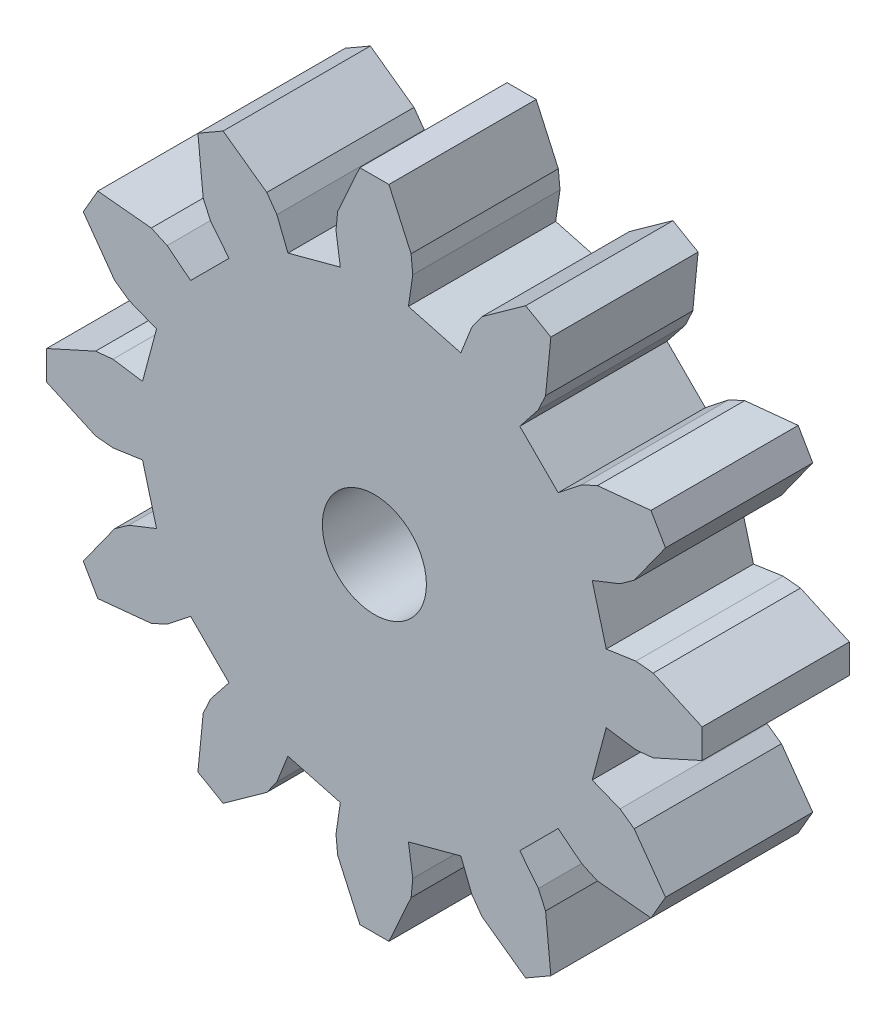
from build123d import *

# Parameters (mm, degrees)
BOSS_EXTRUDE1_DEPTH = 3
SKETCH2_R           = 1.06
CUT_EXTRUDE1_DEPTH  = 3


with BuildPart() as part:
    # Model → Boss-Extrude1 (new body)
    with BuildSketch(Plane.XY):
        Polygon((85.038482334, 125.842661122), (85.641402334, 125.931201122), (85.995047634, 125.896821579), (86.992422179, 125.445319522), (86.992422179, 124.852599522), (85.995047634, 124.401097464), (85.641402334, 124.366717921), (85.038482334, 124.455257921), (84.752432117, 123.387727108), (85.31884426, 123.162940226), (85.607924576, 122.95635), (86.245924576, 122.06665), (85.949564326, 121.553339567), (84.86006114, 121.661009882), (84.536608908, 121.80806635), (84.058733602, 122.186202635), (83.277245674, 121.404714707), (83.65538196, 120.926839402), (83.802438428, 120.60338717), (83.910108743, 119.513883983), (83.39679831, 119.217523733), (82.50709831, 119.855523733), (82.300508083, 120.14460405), (82.075721201, 120.711016193), (81.008190388, 120.424965975), (81.096730388, 119.822045975), (81.062350845, 119.468400675), (80.610848788, 118.471026131), (80.018128788, 118.471026131), (79.566626731, 119.468400675), (79.532247188, 119.822045975), (79.620787188, 120.424965975), (78.553256375, 120.711016193), (78.328469493, 120.14460405), (78.121879267, 119.855523733), (77.232179267, 119.217523733), (76.718868834, 119.513883983), (76.826539148, 120.60338717), (76.973595617, 120.926839402), (77.351731902, 121.404714707), (76.570243974, 122.186202635), (76.092368668, 121.80806635), (75.768916436, 121.661009882), (74.67941325, 121.553339567), (74.383053, 122.06665), (75.021053, 122.95635), (75.310133317, 123.162940226), (75.87654546, 123.387727108), (75.590503, 124.45526), (74.987583, 124.36672), (74.633937545, 124.401097943), (73.636563, 124.8526), (73.636563, 125.44532), (74.633937545, 125.896822057), (74.987582844, 125.9312016), (75.590502844, 125.8426616), (75.876553062, 126.910192413), (75.310140919, 127.134979295), (75.021060603, 127.341569522), (74.383060603, 128.231269522), (74.679420853, 128.744579955), (75.768924039, 128.63690964), (76.092376271, 128.489853171), (76.570251576, 128.111716886), (77.351739505, 128.893204814), (76.973603219, 129.37108012), (76.826546751, 129.694532352), (76.718876436, 130.784035538), (77.232186869, 131.080395788), (78.121886869, 130.442395788), (78.328477095, 130.153315471), (78.553263977, 129.586903328), (79.62079479, 129.872953546), (79.53225479, 130.475873546), (79.566634333, 130.829518846), (80.018136391, 131.826893391), (80.610856391, 131.826893391), (81.062358448, 130.829518846), (81.096737991, 130.475873546), (81.008197991, 129.872953546), (82.075728804, 129.586903328), (82.300515686, 130.153315471), (82.507105912, 130.442395788), (83.396805912, 131.080395788), (83.910116345, 130.784035538), (83.80244603, 129.694532352), (83.655389562, 129.37108012), (83.277253277, 128.893204814), (84.058741205, 128.111716886), (84.536616511, 128.489853171), (84.860068742, 128.63690964), (85.949571929, 128.744579955), (86.245932179, 128.231269522), (85.607932179, 127.341569522), (85.318851862, 127.134979295), (84.75243916, 126.910193822), align=None)
    extrude(amount=BOSS_EXTRUDE1_DEPTH)

    # Sketch2 → Cut-Extrude1 (cut)
    with BuildSketch(Plane.XY.offset(3)):
        with Locations((80.314492489, 125.148960513)):
            Circle(SKETCH2_R)
    extrude(amount=-CUT_EXTRUDE1_DEPTH, mode=Mode.SUBTRACT)


solid = part.part
